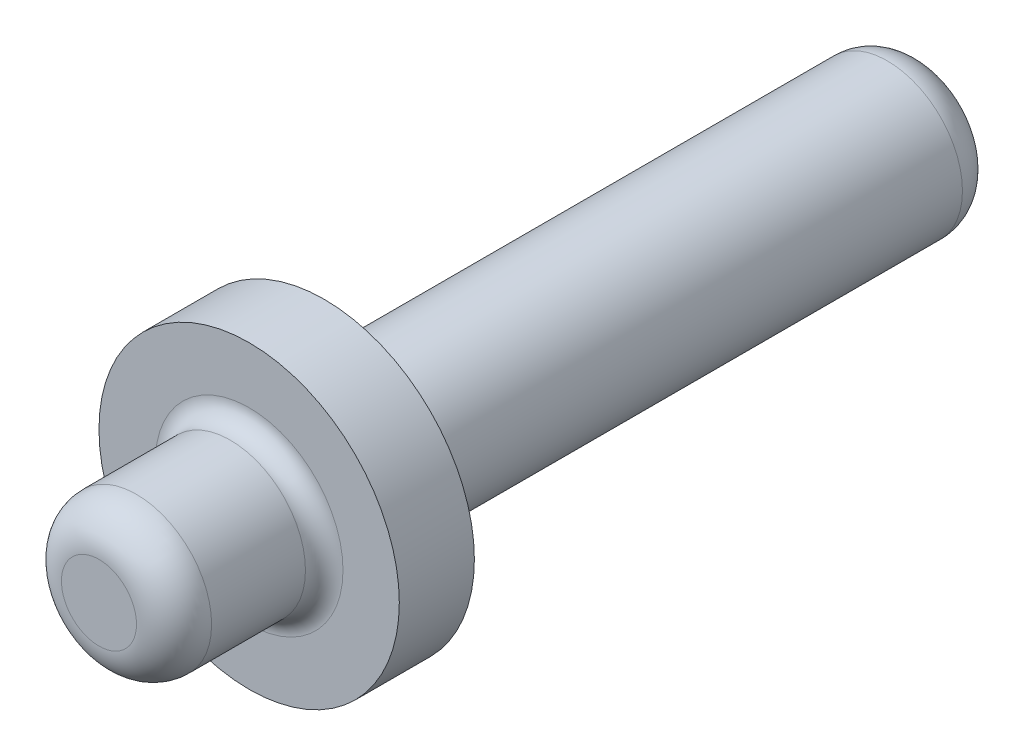
from build123d import *

# Parameters (mm, degrees)
SKETCH1_R           = 3.175
BOSS_EXTRUDE1_DEPTH = 25.4
SKETCH2_R           = 6.35
BOSS_EXTRUDE2_DEPTH = 3.175
SKETCH3_R           = 3.175
BOSS_EXTRUDE3_DEPTH = 6.35
FILLET1_R           = 1.5875
FILLET2_R           = 0.79375


with BuildPart() as part:
    # Sketch1 → Boss-Extrude1 (new body)
    with BuildSketch(Plane.XY):
        Circle(SKETCH1_R)
    extrude(amount=BOSS_EXTRUDE1_DEPTH)

    # Sketch2 → Boss-Extrude2 (add)
    with BuildSketch(Plane.XY.offset(25.4)):
        Circle(SKETCH2_R)
    extrude(amount=BOSS_EXTRUDE2_DEPTH)

    # Sketch3 → Boss-Extrude3 (add)
    with BuildSketch(Plane.XY.offset(28.575)):
        Circle(SKETCH3_R)
    extrude(amount=BOSS_EXTRUDE3_DEPTH)

    # Fillet1
    fillet1_edges = [part.edges().sort_by_distance(p)[0] for p in [
        (-3.175, 0, 34.925),
        (-3.175, 0, 0),
    ]]
    fillet(fillet1_edges, radius=FILLET1_R)

    # Fillet2
    fillet2_edges = [part.edges().sort_by_distance(p)[0] for p in [
        (-3.175, 0, 28.575),
        (-3.175, 0, 25.4),
    ]]
    fillet(fillet2_edges, radius=FILLET2_R)


solid = part.part
